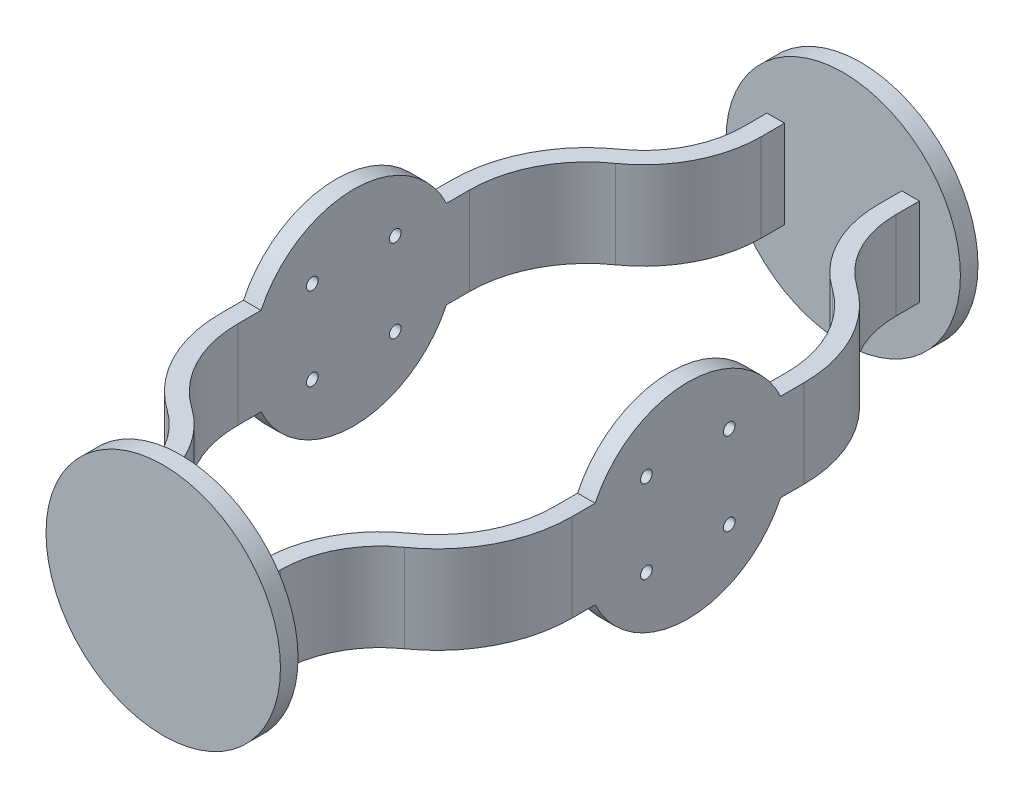
from build123d import *

# Parameters (mm, degrees)
BOSS_EXTRUDE1_DEPTH = 25
SKETCH2_R           = 1
BOSS_EXTRUDE2_DEPTH = 25
SKETCH3_R           = 20
BOSS_EXTRUDE3_DEPTH = 3


with BuildPart() as part:
    # Sketch1 → Boss-Extrude1 (new, symmetric)
    with BuildSketch(Plane(origin=(0, 0, 0), x_dir=(1, 0, 0), z_dir=(0, 1, 0))):
        with BuildLine():
            Line((-27, -19.773863656), (-27, 19.773863656))
            ThreePointArc((-27, 19.773863656), (-24.748239349, 28.993408113), (-18.5, 36.136931828))
            ThreePointArc((-18.5, 36.136931828), (-12.251760651, 43.280455543), (-10, 52.5))
            Line((-10, 52.5), (-10, 59.5))
            Line((-10, 59.5), (-13, 59.5))
            Line((-13, 59.5), (-13, 52.5))
            ThreePointArc((-13, 52.5), (-14.913996553, 44.663387211), (-20.225, 38.591392054))
            ThreePointArc((-20.225, 38.591392054), (-27.410475252, 30.376339782), (-30, 19.773863656))
            Line((-30, 19.773863656), (-30, -19.773863656))
            ThreePointArc((-30, -19.773863656), (-27.410475252, -30.376339782), (-20.225, -38.591392054))
            ThreePointArc((-20.225, -38.591392054), (-14.913996553, -44.663387211), (-13, -52.5))
            Line((-13, -52.5), (-13, -59.5))
            Line((-13, -59.5), (-10, -59.5))
            Line((-10, -59.5), (-10, -52.5))
            ThreePointArc((-10, -52.5), (-12.251760651, -43.280455543), (-18.5, -36.136931828))
            ThreePointArc((-18.5, -36.136931828), (-24.748239349, -28.993408113), (-27, -19.773863656))
        make_face()
    extrude(amount=BOSS_EXTRUDE1_DEPTH, both=True)


with BuildPart() as body_2:
    # Sketch2 → Boss-Extrude2 (new, symmetric)
    with BuildSketch(Plane(origin=(-27, 0, 0), x_dir=(0, 0, -1), z_dir=(1, 0, 0))):
        with BuildLine():
            Line((15.811388301, -7.5), (59.5, -7.5))
            Line((59.5, -7.5), (59.5, 7.5))
            Line((59.5, 7.5), (15.811388301, 7.5))
            ThreePointArc((15.811388301, 7.5), (0, 17.5), (-15.811388301, 7.5))
            Line((-15.811388301, 7.5), (-59.5, 7.5))
            Line((-59.5, 7.5), (-59.5, -7.5))
            Line((-59.5, -7.5), (-15.811388301, -7.5))
            ThreePointArc((-15.811388301, -7.5), (0, -17.5), (15.811388301, -7.5))
        make_face()
        with Locations((7.071067812, -7.071067812)):
            Circle(SKETCH2_R, mode=Mode.SUBTRACT)
        with Locations((-7.071067812, -7.071067812)):
            Circle(SKETCH2_R, mode=Mode.SUBTRACT)
        with Locations((-7.071067812, 7.071067812)):
            Circle(SKETCH2_R, mode=Mode.SUBTRACT)
        with Locations((7.071067812, 7.071067812)):
            Circle(SKETCH2_R, mode=Mode.SUBTRACT)
    extrude(amount=BOSS_EXTRUDE2_DEPTH, both=True)

    # Combine1: intersect part
    add(part.part, mode=Mode.INTERSECT)


with BuildPart() as body_2_2:
    # Mirror3: mirrored copy
    add(body_2.part.mirror(Plane(origin=(0, 0, 0), x_dir=(0, 0, 1), z_dir=(1, 0, 0))))


with BuildPart() as body_2_1:
    add(body_2.part)

    add(body_2_2.part)  # Boss-Extrude3 merges body 2 2
    # Sketch3 → Boss-Extrude3 (add)
    with BuildSketch(Plane(origin=(0, 0, -59.5), x_dir=(-1, 0, 0), z_dir=(0, 0, -1))):
        Circle(SKETCH3_R)
    boss_extrude3 = extrude(amount=-BOSS_EXTRUDE3_DEPTH)

    # Mirror4: Boss-Extrude3 across plane
    add(boss_extrude3.mirror(Plane.XY))


solid = body_2_1.part
